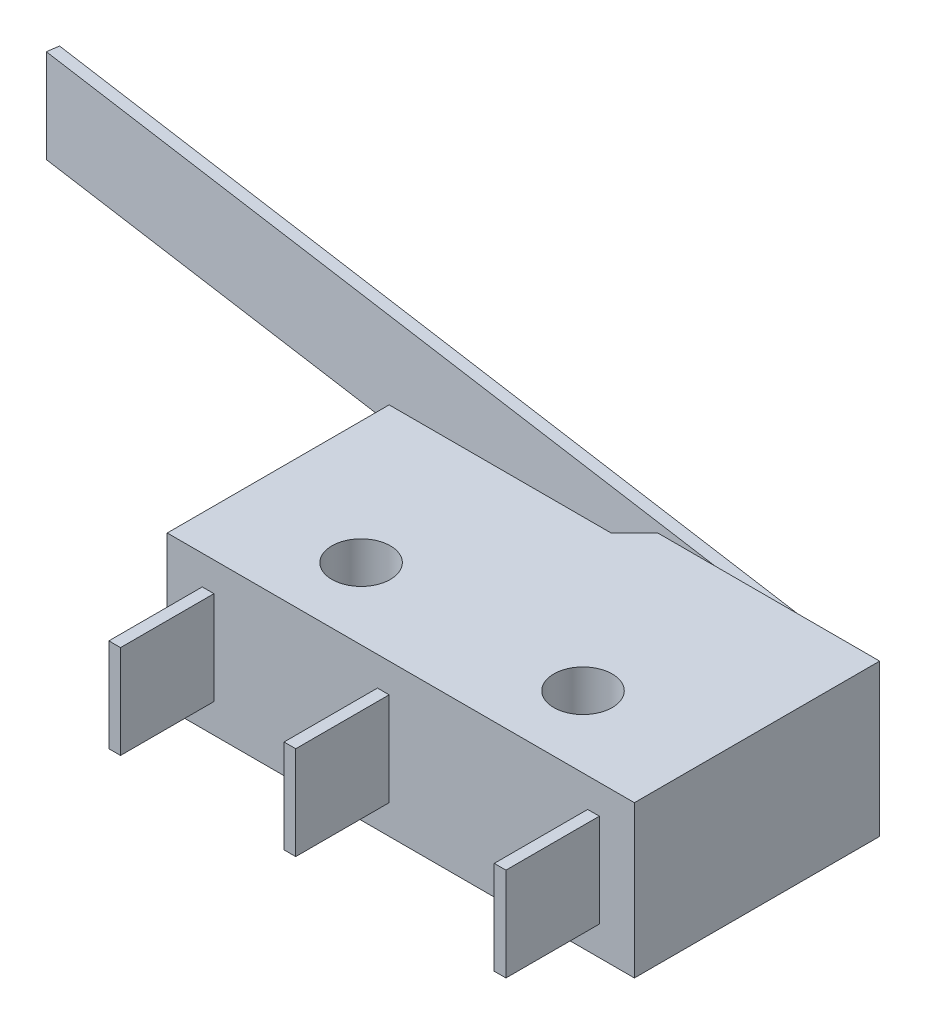
from build123d import *

# Parameters (mm, degrees)
BOSS_EXTRUDE1_DEPTH = 3.25
SKETCH2_W           = 0.5
SKETCH2_H           = 4
BOSS_EXTRUDE2_DEPTH = 2
SKETCH3_R           = 1.25
CUT_EXTRUDE1_DEPTH  = 14


with BuildPart() as part:
    # Sketch1 → Boss-Extrude1 (new, symmetric)
    with BuildSketch(Plane(origin=(0, 0, 0), x_dir=(1, 0, 0), z_dir=(0, 1, 0))):
        Polygon((0, 9.5), (9.5, 9.5), (10.5, 10.5), (20, 10.5), (20, 0), (0, 0), align=None)
    extrude(amount=BOSS_EXTRUDE1_DEPTH, both=True)

    # Sketch2 → Boss-Extrude2 (add, symmetric)
    with BuildSketch(Plane(origin=(0, 0, 0), x_dir=(1, 0, 0), z_dir=(0, 1, 0))):
        Polygon((17, 10.5), (17, 11.5), (-21.610231805, 17), (-21.680744625, 16.504997028), (16.5, 11.066177171), (16.5, 10.5), align=None)
        with Locations((18.25, -2)):
            Rectangle(SKETCH2_W, SKETCH2_H)
        with Locations((9.25, -2)):
            Rectangle(SKETCH2_W, SKETCH2_H)
        with Locations((1.75, -2)):
            Rectangle(SKETCH2_W, SKETCH2_H)
    extrude(amount=BOSS_EXTRUDE2_DEPTH, both=True)

    # Sketch3 → Cut-Extrude1 (cut)
    with BuildSketch(Plane(origin=(0, 3.25, 0), x_dir=(1, 0, 0), z_dir=(0, 1, 0))):
        with Locations(Location((5.25, 3.05, 0), (0, 0, 270))):
            Circle(SKETCH3_R)
        with Locations(Location((14.75, 3.05, 0), (0, 0, 270))):
            Circle(SKETCH3_R)
    extrude(amount=-CUT_EXTRUDE1_DEPTH, mode=Mode.SUBTRACT)


solid = part.part
